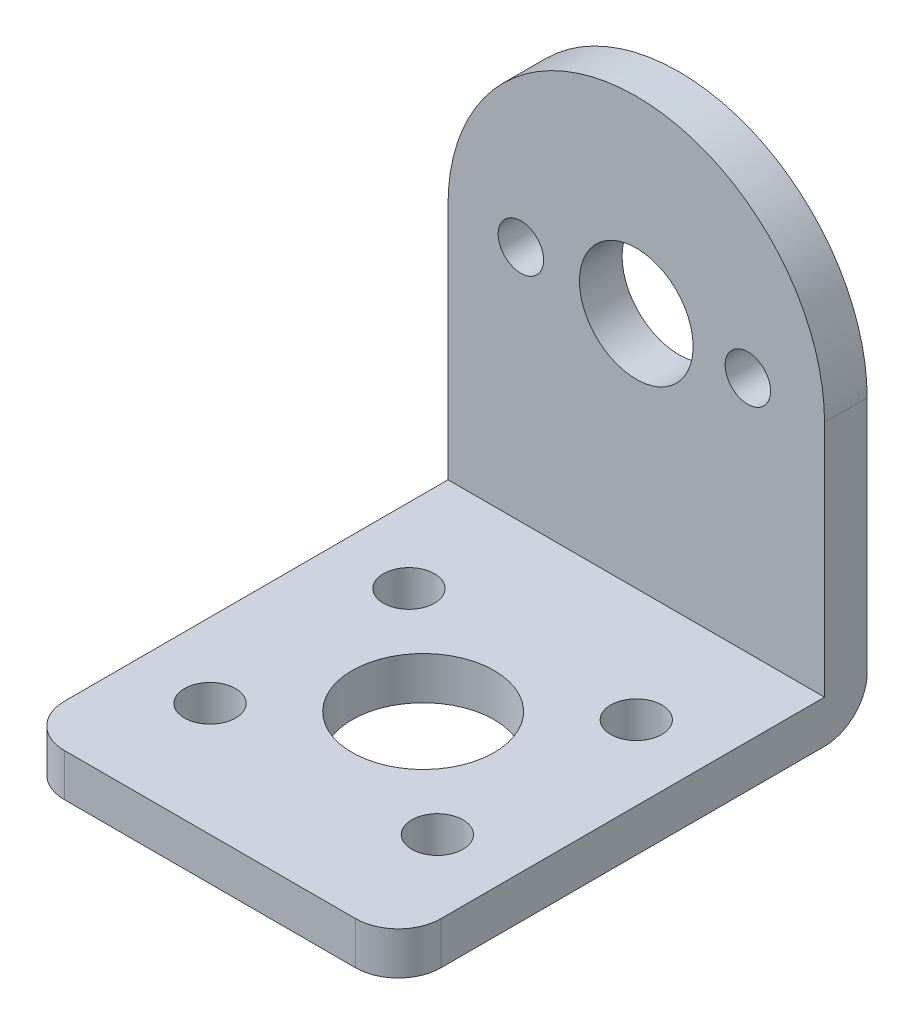
from build123d import *

# Parameters (mm, degrees)
EXTRUDE_1_DEPTH          = 3
SKETCH_2_W               = 26.5
SKETCH_2_H               = 3
EXTRUDE_2_DEPTH          = 30
FILLET_1_R               = 3
FILLET_2_R               = 3
CUT_EXTRUDE_1_DEPTH      = 41.677082
CUT_EXTRUDE_1_DEPTH_BACK = 41.677082
SKETCH_3_R               = 4
CUT_EXTRUDE_2_DEPTH      = 41.677082
CUT_EXTRUDE_2_DEPTH_BACK = 41.677082
SKETCH_4_R               = 1.6
CUT_EXTRUDE_3_DEPTH      = 49.513529041
CUT_EXTRUDE_3_DEPTH_BACK = 49.513529041
SKETCH_5_R               = 5
CUT_EXTRUDE_4_DEPTH      = 49.513529041
CUT_EXTRUDE_4_DEPTH_BACK = 49.513529041
SKETCH_6_R               = 1.8


with BuildPart() as part:
    # 草图1 → 凸台-拉伸1 (new body)
    with BuildSketch(Plane.XY):
        with BuildLine():
            Line((13.25, 0), (13.25, -19.75))
            Line((13.25, -19.75), (-13.25, -19.75))
            Line((-13.25, -19.75), (-13.25, 0))
            ThreePointArc((-13.25, 0), (0, 13.25), (13.25, 0))
        make_face()
    extrude(amount=EXTRUDE_1_DEPTH)

    # 草图2 → 凸台-拉伸2 (add)
    with BuildSketch(Plane.XY.offset(3)):
        with Locations((0, -18.25)):
            Rectangle(SKETCH_2_W, SKETCH_2_H)
    extrude(amount=EXTRUDE_2_DEPTH)

    # 圆角1
    fillet_1_edges = [part.edges().sort_by_distance(p)[0] for p in [
        (0, -19.75, 0),
    ]]
    fillet(fillet_1_edges, radius=FILLET_1_R)

    # 圆角2
    fillet_2_edges = [part.edges().sort_by_distance(p)[0] for p in [
        (-13.25, -18.25, 33),
        (13.25, -18.25, 33),
    ]]
    fillet(fillet_2_edges, radius=FILLET_2_R)

    # 草图3 → 切除-拉伸1 (cut, two sides: drawn at the far end of the back side and taken through both)
    with BuildSketch(Plane(origin=(0, 0, 0), x_dir=(-1, 0, 0), z_dir=(0, 0, -1)).offset(-CUT_EXTRUDE_1_DEPTH_BACK)):
        with Locations(Location((0, 0, 0), (0, 0, 180))):
            Circle(SKETCH_3_R)
    extrude(amount=CUT_EXTRUDE_1_DEPTH + CUT_EXTRUDE_1_DEPTH_BACK, mode=Mode.SUBTRACT)

    # 草图4 → 切除-拉伸2 (cut, two sides: drawn at the far end of the back side and taken through both)
    with BuildSketch(Plane(origin=(0, 0, 0), x_dir=(-1, 0, 0), z_dir=(0, 0, -1)).offset(-CUT_EXTRUDE_2_DEPTH_BACK)):
        with Locations(Location((8.121035447, 0, 0), (0, 0, 180))):
            Circle(SKETCH_4_R)
        with Locations(Location((-7.851829852, 0, 0), (0, 0, 180))):
            Circle(SKETCH_4_R)
    extrude(amount=CUT_EXTRUDE_2_DEPTH + CUT_EXTRUDE_2_DEPTH_BACK, mode=Mode.SUBTRACT)

    # 草图5 → 切除-拉伸3 (cut, two sides: drawn at the far end of the back side and taken through both)
    with BuildSketch(Plane(origin=(0, -19.75, 0), x_dir=(-1, 0, 0), z_dir=(0, -1, 0)).offset(-CUT_EXTRUDE_3_DEPTH_BACK)):
        with Locations(Location((0, -18, 0), (0, 0, 90))):
            Circle(SKETCH_5_R)
    extrude(amount=CUT_EXTRUDE_3_DEPTH + CUT_EXTRUDE_3_DEPTH_BACK, mode=Mode.SUBTRACT)

    # 草图6 → 切除-拉伸4 (cut, two sides: drawn at the far end of the back side and taken through both)
    with BuildSketch(Plane(origin=(0, -19.75, 0), x_dir=(-1, 0, 0), z_dir=(0, -1, 0)).offset(-CUT_EXTRUDE_4_DEPTH_BACK)):
        with Locations(Location((-8, -11, 0), (0, 0, 90))):
            Circle(SKETCH_6_R)
        with Locations(Location((8, -11, 0), (0, 0, 90))):
            Circle(SKETCH_6_R)
        with Locations(Location((8, -25, 0), (0, 0, 90))):
            Circle(SKETCH_6_R)
        with Locations(Location((-8, -25, 0), (0, 0, 90))):
            Circle(SKETCH_6_R)
    extrude(amount=CUT_EXTRUDE_4_DEPTH + CUT_EXTRUDE_4_DEPTH_BACK, mode=Mode.SUBTRACT)


solid = part.part
